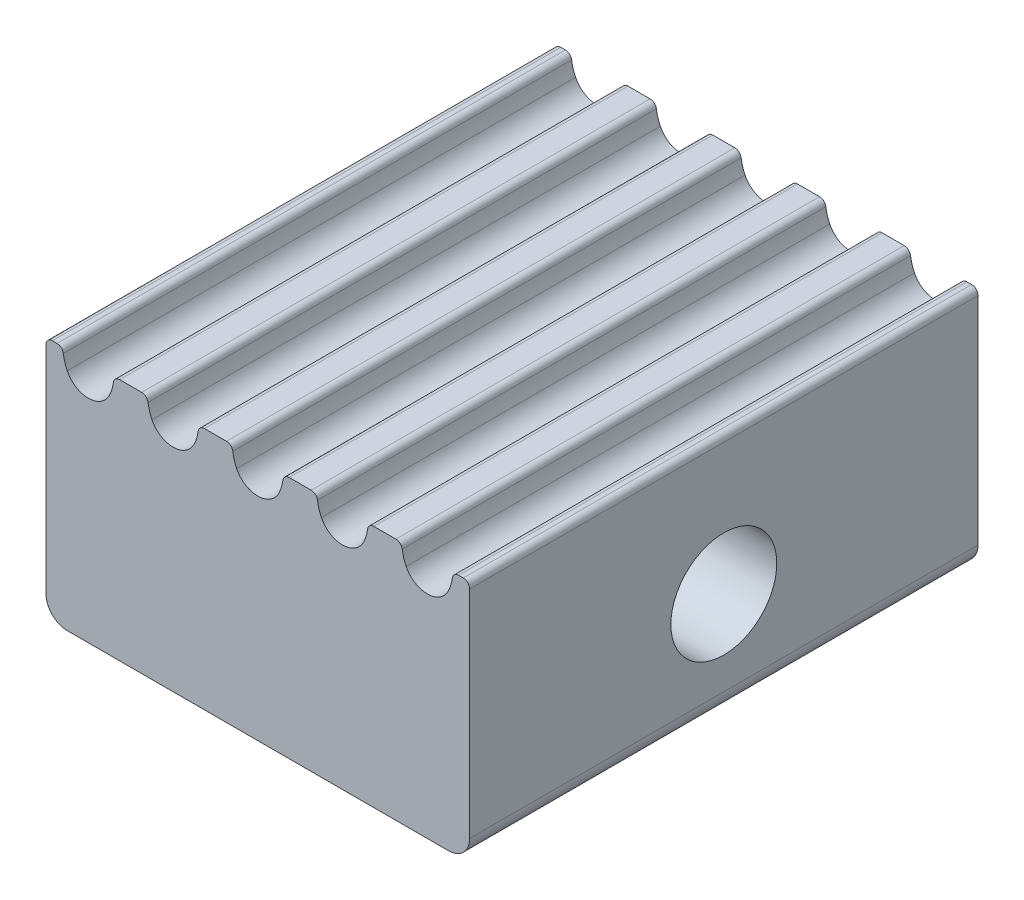
from build123d import *

# Parameters (mm, degrees)
BOSS_EXTRUDE1_DEPTH             = 6
LPATTERN1_COUNT                 = 5
LPATTERN1_PITCH                 = 2
SKETCH4_W                       = 10
SKETCH4_H                       = 6.004
BOSS_EXTRUDE3_DEPTH             = 6
M3X0_5_TAPPED_HOLE1_D           = 2.5
M3X0_5_TAPPED_HOLE1_CSINK_D     = 3.05
M3X0_5_TAPPED_HOLE1_CSINK_ANGLE = 90
FILLET1_R                       = 0.5
FILLET2_R                       = 0.15


with BuildPart() as part:
    # Sketch1 → Boss-Extrude1 (new, symmetric)
    with BuildSketch(Plane.XY):
        with BuildLine():
            Line((0, 0), (1, 0))
            Line((1, 0), (1, -1.004))
            ThreePointArc((1, -1.004), (0.705850588, -0.919639059), (0.501123596, -0.692202247))
            ThreePointArc((0.501123596, -0.692202247), (0.442388286, -0.542062154), (0.408543109, -0.384434783))
            ThreePointArc((0.408543109, -0.384434783), (0.358731646, -0.291228588), (0.259824575, -0.254))
            Line((0.259824575, -0.254), (0, -0.254))
            Line((0, -0.254), (0, 0))
        make_face()
    extrude(amount=BOSS_EXTRUDE1_DEPTH, both=True)

    # Mirror1: part across plane


with BuildPart() as part_1:
    add(part.part)
    add(part.part.mirror(Plane(origin=(1, 0, 6), x_dir=(0, 0, 1), z_dir=(-1, 0, 0))))


with BuildPart() as lpattern1_1:
    # LPattern1: pattern copy
    add(part_1.part.moved(Location(Vector(-1, 0, 0) * (1 * LPATTERN1_PITCH))))


with BuildPart() as lpattern1_2:
    # LPattern1: pattern copy
    add(part_1.part.moved(Location(Vector(-1, 0, 0) * (2 * LPATTERN1_PITCH))))


with BuildPart() as lpattern1_3:
    # LPattern1: pattern copy
    add(part_1.part.moved(Location(Vector(-1, 0, 0) * (3 * LPATTERN1_PITCH))))


with BuildPart() as lpattern1_4:
    # LPattern1: pattern copy
    add(part_1.part.moved(Location(Vector(-1, 0, 0) * (4 * LPATTERN1_PITCH))))


with BuildPart() as lpattern1_1_1:
    add(lpattern1_1.part)

    # Combine1: union LPattern1_4, part, LPattern1_3, LPattern1_2
    add(lpattern1_4.part)
    add(part_1.part)
    add(lpattern1_3.part)
    add(lpattern1_2.part)


with BuildPart() as body_2:
    # Sketch4 → Boss-Extrude3 (new, symmetric)
    with BuildSketch(Plane.XY):
        with Locations((-3, -3.002)):
            Rectangle(SKETCH4_W, SKETCH4_H)
    extrude(amount=BOSS_EXTRUDE3_DEPTH, both=True)

    # Combine2: cut LPattern1_1
    add(lpattern1_1_1.part, mode=Mode.SUBTRACT)

    # M3x0.5 Tapped Hole1 (through all)
    with Locations(Plane.ZY.offset(8)):
        with Locations((0, -3.504)):
            CounterSinkHole(M3X0_5_TAPPED_HOLE1_D / 2, M3X0_5_TAPPED_HOLE1_CSINK_D / 2, counter_sink_angle=M3X0_5_TAPPED_HOLE1_CSINK_ANGLE)

    # Fillet1
    fillet1_edges = [body_2.edges().sort_by_distance(p)[0] for p in [
        (2, -6.004, 0),
        (-8, -6.004, 0),
    ]]
    fillet(fillet1_edges, radius=FILLET1_R)

    # Fillet2
    fillet2_edges = [body_2.edges().sort_by_distance(p)[0] for p in [
        (-8, -0.254, 0),
        (2, -0.254, 0),
    ]]
    fillet(fillet2_edges, radius=FILLET2_R)


solid = body_2.part
